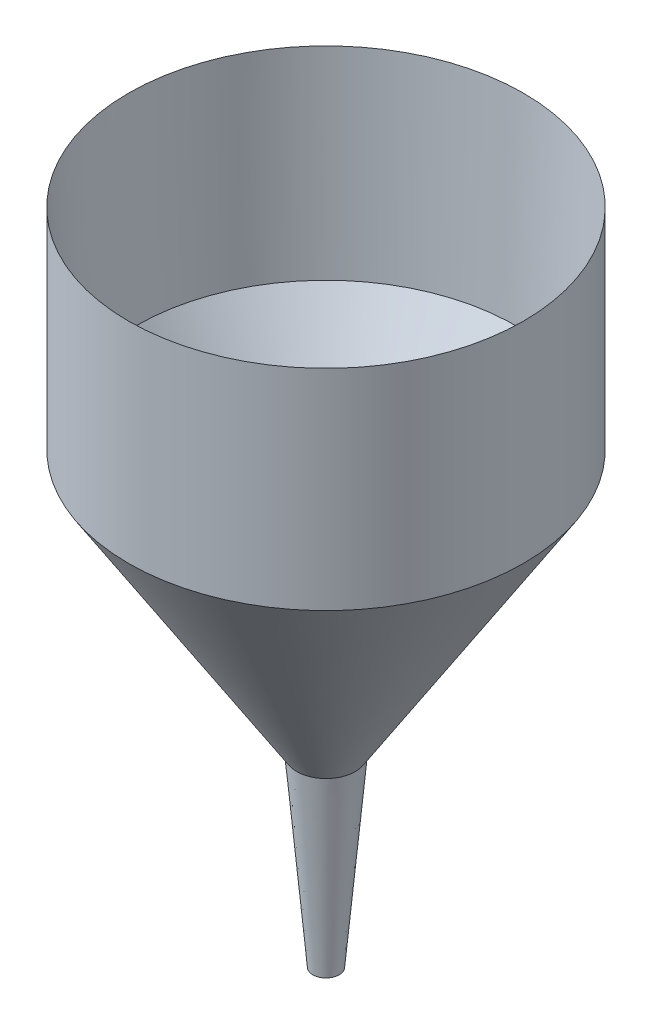
from build123d import *


with BuildPart() as part:
    # Sketch2 → Revolve3 (revolve)
    with BuildSketch(Plane.XY):
        Polygon((-15, 50), (-15, 34.063601054), (-2.223228953, 13.981570915), (-1, 0), (-1, 13.921857085), (-14.410656389, 35.000203469), align=None)
    revolve(axis=Axis((0, 50, 0), (0, -1, 0)))


solid = part.part
